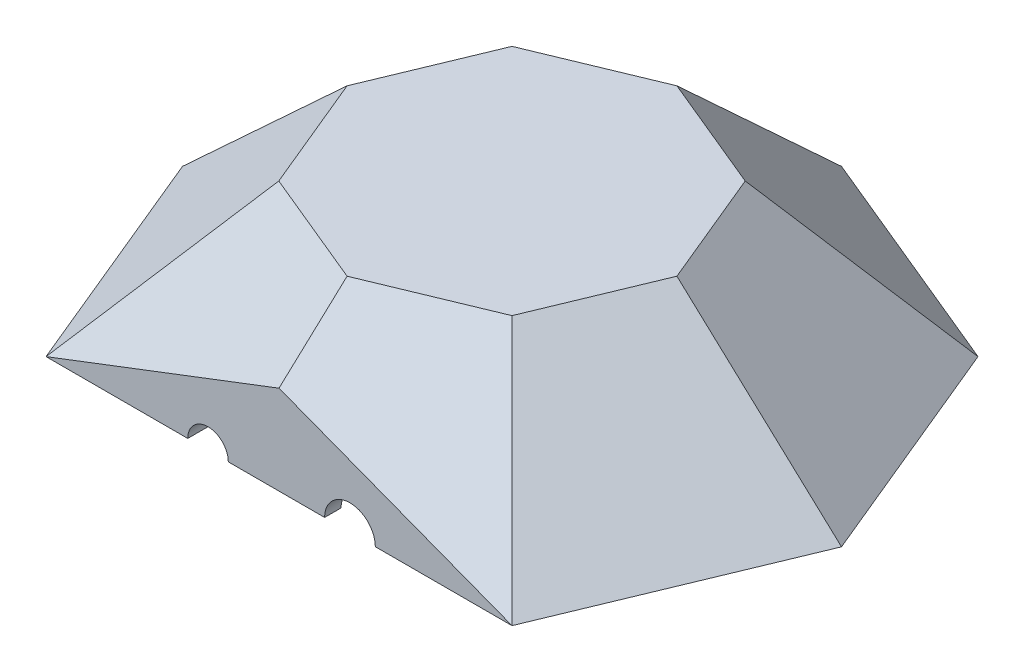
from build123d import *

# Parameters (mm, degrees)
AUFSATZ_LINEAR_AUSTRAGEN1_DEPTH       = 30
SCHNITT_LINEAR_AUSTRAGEN4_DEPTH       = 162.727828845
SCHNITT_LINEAR_AUSTRAGEN5_DEPTH       = 162.727828845
SCHNITT_LINEAR_AUSTRAGEN6_DEPTH       = 162.727828845
SCHNITT_LINEAR_AUSTRAGEN7_DEPTH       = 162.727828845
WANDUNG1_T                            = -3
SCHNITT_LINEAR_AUSTRAGEN12_DEPTH      = 97.695398029
SCHNITT_LINEAR_AUSTRAGEN12_DEPTH_BACK = 97.695398029
AUFSATZ_LINEAR_AUSTRAGEN3_REACH       = 98.695
SKIZZE17_W                            = 85.429528352
SKIZZE17_H                            = 3.247176601
SCHNITT_LINEAR_AUSTRAGEN14_REACH      = 134.051
SKIZZE18_R                            = 4
SKIZZE18_R_2                          = 5
AUFSATZ_LINEAR_AUSTRAGEN4_DEPTH       = 0.75
AUFSATZ_LINEAR_AUSTRAGEN5_DEPTH       = 2
AUFSATZ_LINEAR_AUSTRAGEN9_REACH       = 98.695
SKIZZE23_R                            = 5.307840289
SKIZZE23_R_2                          = 5
SKIZZE25_R                            = 3.2
SCHNITT_LINEAR_AUSTRAGEN15_DEPTH      = 2.05
SCHNITT_LINEAR_AUSTRAGEN16_DEPTH      = 110.772492001
SCHNITT_LINEAR_AUSTRAGEN16_DEPTH_BACK = 110.772492001
SKIZZE26_W                            = 129.973453239
SKIZZE26_H                            = 30


with BuildPart() as part:
    # Skizze1 → Aufsatz-Linear austragen1 (new body)
    with BuildSketch(Plane(origin=(0, 0, 0), x_dir=(1, 0, 0), z_dir=(0, 1, 0))):
        Polygon((45.961940777, -45.961940777), (65, 0), (45.961940777, 45.961940777), (0, 65), (-45.961940777, 45.961940777), (-65, 0), (-45.961940777, -45.961940777), (0, -65), align=None)
    extrude(amount=AUFSATZ_LINEAR_AUSTRAGEN1_DEPTH)

    # Skizze6 → Schnitt-Linear austragen4 (cut, through all)
    with BuildSketch(Plane(origin=(-26.807804712, 0, 64.719765714), x_dir=(0.9238795325112876, 0, 0.3826834323650878), z_dir=(-0.38268343236508773, 0, 0.9238795325112875))):
        Polygon((-60.052169613, 30), (-30.052169613, 0), (-60.052169613, 0), align=None)
        Polygon((30.052169613, 0), (60.052169613, 30), (60.052169613, 0), align=None)
    extrude(amount=-SCHNITT_LINEAR_AUSTRAGEN4_DEPTH, mode=Mode.SUBTRACT)

    # Skizze7 → Schnitt-Linear austragen5 (cut, through all)
    with BuildSketch(Plane(origin=(-64.719765714, 0, 26.807804712), x_dir=(0.3826834323650837, 0, 0.9238795325112893), z_dir=(-0.9238795325112893, 0, 0.3826834323650837))):
        Polygon((-60.052169613, 30), (-30.052169613, 0), (-60.052169613, 0), align=None)
        Polygon((30.052169613, 0), (60.052169613, 0), (60.052169613, 30), align=None)
    extrude(amount=-SCHNITT_LINEAR_AUSTRAGEN5_DEPTH, mode=Mode.SUBTRACT)

    # Skizze8 → Schnitt-Linear austragen6 (cut, through all)
    with BuildSketch(Plane(origin=(-64.719765714, 0, -26.807804712), x_dir=(-0.38268343236508795, 0, 0.9238795325112876), z_dir=(-0.9238795325112876, 0, -0.38268343236508795))):
        Polygon((-60.052169613, 30), (-60.052169613, 0), (-30.052169613, 0), align=None)
        Polygon((60.052169613, 30), (60.052169613, 0), (30.052169613, 0), align=None)
    extrude(amount=-SCHNITT_LINEAR_AUSTRAGEN6_DEPTH, mode=Mode.SUBTRACT)

    # Skizze9 → Schnitt-Linear austragen7 (cut, through all)
    with BuildSketch(Plane(origin=(-26.807804712, 0, -64.719765714), x_dir=(-0.9238795325112894, 0, 0.3826834323650834), z_dir=(-0.3826834323650834, 0, -0.9238795325112894))):
        Polygon((60.052169613, 30), (60.052169613, 0), (30.052169613, 0), align=None)
        Polygon((-60.052169613, 30), (-60.052169613, 0), (-30.052169613, 0), align=None)
    extrude(amount=-SCHNITT_LINEAR_AUSTRAGEN7_DEPTH, mode=Mode.SUBTRACT)

    # Wandung1
    wandung1_openings = [part.faces().sort_by_distance(p)[0] for p in [
        (0, 30, 0),
    ]]
    offset(amount=WANDUNG1_T, openings=wandung1_openings, kind=Kind.INTERSECTION)

    # Skizze15 → Schnitt-Linear austragen12 (cut, two sides: drawn at the far end of the back side and taken through both)
    with BuildSketch(Plane(origin=(0, 0, 0), x_dir=(0, 0, -1), z_dir=(1, 0, 0)).offset(-SCHNITT_LINEAR_AUSTRAGEN12_DEPTH_BACK)):
        Polygon((-45.961940777, 30), (-45.961940777, 12.411126745), (-65, 30), align=None)
    extrude(amount=SCHNITT_LINEAR_AUSTRAGEN12_DEPTH + SCHNITT_LINEAR_AUSTRAGEN12_DEPTH_BACK, mode=Mode.SUBTRACT)

    # Skizze17 → Aufsatz-Linear austragen3 (add, up to next)
    with BuildSketch(Plane(origin=(0, 30, 0), x_dir=(1, 0, 0), z_dir=(0, 1, 0)), mode=Mode.PRIVATE) as aufsatz_linear_austragen3_sk1:
        with Locations((0, -44.338352477)):
            Rectangle(SKIZZE17_W, SKIZZE17_H)
    aufsatz_linear_austragen3_tool1 = extrude(aufsatz_linear_austragen3_sk1.sketch, amount=-AUFSATZ_LINEAR_AUSTRAGEN3_REACH, mode=Mode.PRIVATE) - part.part
    add(aufsatz_linear_austragen3_tool1.solids().sort_by_distance((0, 30, 44.338352))[0])

    # Skizze18 → Schnitt-Linear austragen14 (cut, up to next)
    with BuildSketch(Plane.XY.offset(45.961940777), mode=Mode.PRIVATE) as schnitt_linear_austragen14_sk1:
        with Locations((-14, 30)):
            Circle(SKIZZE18_R)
    schnitt_linear_austragen14_tool1 = extrude(schnitt_linear_austragen14_sk1.sketch, amount=-SCHNITT_LINEAR_AUSTRAGEN14_REACH, mode=Mode.PRIVATE) & part.part
    # Skizze18 → Schnitt-Linear austragen14 (cut, up to next)
    with BuildSketch(Plane.XY.offset(45.961940777), mode=Mode.PRIVATE) as schnitt_linear_austragen14_sk2:
        with Locations((14, 30)):
            Circle(SKIZZE18_R_2)
    schnitt_linear_austragen14_tool2 = extrude(schnitt_linear_austragen14_sk2.sketch, amount=-SCHNITT_LINEAR_AUSTRAGEN14_REACH, mode=Mode.PRIVATE) & part.part
    add(schnitt_linear_austragen14_tool1.solids().sort_by_distance((-14, 30, 45.961941))[0], mode=Mode.SUBTRACT)
    add(schnitt_linear_austragen14_tool2.solids().sort_by_distance((14, 30, 45.961941))[0], mode=Mode.SUBTRACT)

    # Skizze19 → Aufsatz-Linear austragen4 (add)
    with BuildSketch(Plane(origin=(0, 0, 42.714764176), x_dir=(-1, 0, 0), z_dir=(0, 0, -1))):
        with BuildLine():
            Line((10, 30), (8, 30))
            ThreePointArc((8, 30), (14, 24), (20, 30))
            Line((20, 30), (18, 30))
            ThreePointArc((18, 30), (14, 26), (10, 30))
        make_face()
    extrude(amount=AUFSATZ_LINEAR_AUSTRAGEN4_DEPTH)

    # Skizze20 → Aufsatz-Linear austragen5 (add)
    with BuildSketch(Plane(origin=(0, 0, 42.714764176), x_dir=(-1, 0, 0), z_dir=(0, 0, -1))):
        with BuildLine():
            Line((8, 30), (5, 30))
            Line((5, 30), (5, 23))
            Line((5, 23), (23, 23))
            Line((23, 23), (23, 30))
            Line((23, 30), (20, 30))
            ThreePointArc((20, 30), (14, 24), (8, 30))
        make_face()
    extrude(amount=AUFSATZ_LINEAR_AUSTRAGEN5_DEPTH)

    # Skizze23 → Aufsatz-Linear austragen9 (add, up to next)
    with BuildSketch(Plane(origin=(0, 30, 0), x_dir=(1, 0, 0), z_dir=(0, 1, 0)), mode=Mode.PRIVATE) as aufsatz_linear_austragen9_sk1:
        with Locations(Location((-52.407798812, 0, 0), (0, 0, 270))):
            Circle(SKIZZE23_R)
    aufsatz_linear_austragen9_tool1 = extrude(aufsatz_linear_austragen9_sk1.sketch, amount=-AUFSATZ_LINEAR_AUSTRAGEN9_REACH, mode=Mode.PRIVATE) - part.part
    # Skizze23 → Aufsatz-Linear austragen9 (add, up to next)
    with BuildSketch(Plane(origin=(0, 30, 0), x_dir=(1, 0, 0), z_dir=(0, 1, 0)), mode=Mode.PRIVATE) as aufsatz_linear_austragen9_sk2:
        with Locations(Location((52.407798812, 0, 0), (0, 0, 270))):
            Circle(SKIZZE23_R_2)
    aufsatz_linear_austragen9_tool2 = extrude(aufsatz_linear_austragen9_sk2.sketch, amount=-AUFSATZ_LINEAR_AUSTRAGEN9_REACH, mode=Mode.PRIVATE) - part.part
    # Skizze23 → Aufsatz-Linear austragen9 (add, up to next)
    with BuildSketch(Plane(origin=(0, 30, 0), x_dir=(1, 0, 0), z_dir=(0, 1, 0)), mode=Mode.PRIVATE) as aufsatz_linear_austragen9_sk3:
        with Locations(Location((0, 52.407798812, 0), (0, 0, 270))):
            Circle(SKIZZE23_R_2)
    aufsatz_linear_austragen9_tool3 = extrude(aufsatz_linear_austragen9_sk3.sketch, amount=-AUFSATZ_LINEAR_AUSTRAGEN9_REACH, mode=Mode.PRIVATE) - part.part
    add(aufsatz_linear_austragen9_tool1.solids().sort_by_distance((-52.407799, 30, 0))[0])
    add(aufsatz_linear_austragen9_tool2.solids().sort_by_distance((52.407799, 30, 0))[0])
    add(aufsatz_linear_austragen9_tool3.solids().sort_by_distance((0, 30, -52.407799))[0])

    # Skizze25 → Schnitt-Linear austragen15 (cut)
    with BuildSketch(Plane(origin=(0, 29.6, 0), x_dir=(1, 0, 0), z_dir=(0, 1, 0))):
        with Locations(Location((0, 52.407798812, 0), (0, 0, 270))):
            Circle(SKIZZE25_R)
        with Locations(Location((52.407798812, 0, 0), (0, 0, 270))):
            Circle(SKIZZE25_R)
        with Locations(Location((-52.407798812, 0, 0), (0, 0, 270))):
            Circle(SKIZZE25_R)
    extrude(amount=-SCHNITT_LINEAR_AUSTRAGEN15_DEPTH, mode=Mode.SUBTRACT)


with BuildPart() as body_2:
    # Spiegeln2: mirrored copy
    add(part.part.mirror(Plane.ZX.offset(30)))


with BuildPart() as part_1:
    add(part.part)

    # Skizze26 → Schnitt-Linear austragen16 (cut, two sides: drawn at the far end of the back side and taken through both)
    with BuildSketch(Plane.XY.offset(-SCHNITT_LINEAR_AUSTRAGEN16_DEPTH_BACK)):
        with Locations((-0.01327338, 15)):
            Rectangle(SKIZZE26_W, SKIZZE26_H)
    extrude(amount=SCHNITT_LINEAR_AUSTRAGEN16_DEPTH + SCHNITT_LINEAR_AUSTRAGEN16_DEPTH_BACK, mode=Mode.SUBTRACT)


solid = Compound([body_2.part, part_1.part])
